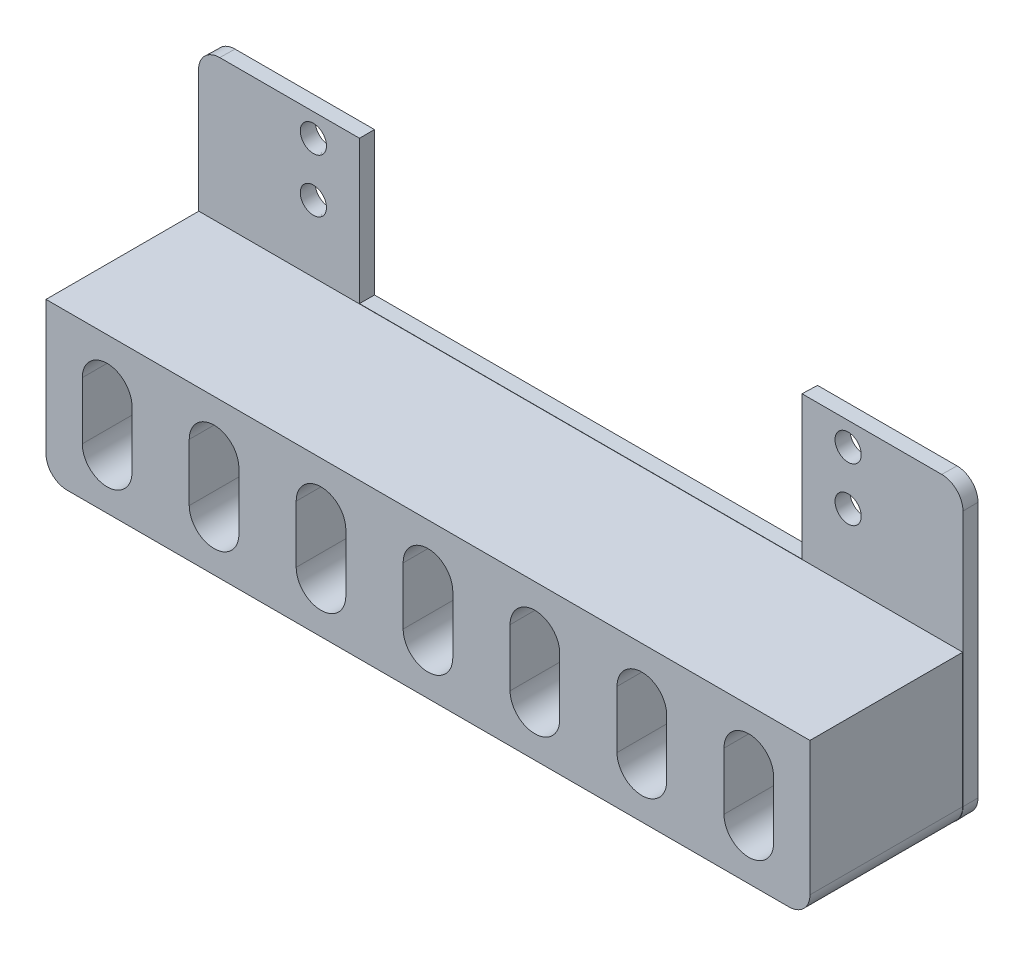
from build123d import *

# Parameters (mm, degrees)
SKETCH_1_R      = 1.75
EXTRUDE_3_DEPTH = 2
EXTRUDE_3_DRAFT = -1
EXTRUDE_4_DEPTH = 22


with BuildPart() as part:
    # 草图1 → 凸台-拉伸3 (with draft: the straight prism first)
    with BuildSketch(Plane.XY):
        with BuildLine():
            ThreePointArc((0, 2.744628665), (0.803883124, 0.803883124), (2.744628665, 0))
            Line((2.744628665, 0), (97.255371335, 0))
            ThreePointArc((97.255371335, 0), (99.196116876, 0.803883124), (100, 2.744628665))
            Line((100, 2.744628665), (100, 36.255371335))
            ThreePointArc((100, 36.255371335), (99.196116876, 38.196116876), (97.255371335, 39))
            Line((97.255371335, 39), (79, 39))
            Line((79, 39), (79, 20.25))
            Line((79, 20.25), (21, 20.25))
            Line((21, 20.25), (21, 39))
            Line((21, 39), (2.744628665, 39))
            ThreePointArc((2.744628665, 39), (0.803883124, 38.196116876), (0, 36.255371335))
            Line((0, 36.255371335), (0, 2.744628665))
        make_face()
        with BuildLine():
            ThreePointArc((11.25, 6.25), (8, 3), (4.75, 6.25))
            Line((4.75, 6.25), (4.75, 13.75))
            ThreePointArc((4.75, 13.75), (8, 17), (11.25, 13.75))
            Line((11.25, 13.75), (11.25, 6.25))
        make_face(mode=Mode.SUBTRACT)
        with BuildLine():
            ThreePointArc((25.25, 6.25), (22, 3), (18.75, 6.25))
            Line((18.75, 6.25), (18.75, 13.75))
            ThreePointArc((18.75, 13.75), (22, 17), (25.25, 13.75))
            Line((25.25, 13.75), (25.25, 6.25))
        make_face(mode=Mode.SUBTRACT)
        with BuildLine():
            ThreePointArc((39.25, 6.25), (36, 3), (32.75, 6.25))
            Line((32.75, 6.25), (32.75, 13.75))
            ThreePointArc((32.75, 13.75), (36, 17), (39.25, 13.75))
            Line((39.25, 13.75), (39.25, 6.25))
        make_face(mode=Mode.SUBTRACT)
        with BuildLine():
            ThreePointArc((53.25, 6.25), (50, 3), (46.75, 6.25))
            Line((46.75, 6.25), (46.75, 13.75))
            ThreePointArc((46.75, 13.75), (50, 17), (53.25, 13.75))
            Line((53.25, 13.75), (53.25, 6.25))
        make_face(mode=Mode.SUBTRACT)
        with BuildLine():
            ThreePointArc((67.25, 6.25), (64, 3), (60.75, 6.25))
            Line((60.75, 6.25), (60.75, 13.75))
            ThreePointArc((60.75, 13.75), (64, 17), (67.25, 13.75))
            Line((67.25, 13.75), (67.25, 6.25))
        make_face(mode=Mode.SUBTRACT)
        with BuildLine():
            ThreePointArc((81.25, 6.25), (78, 3), (74.75, 6.25))
            Line((74.75, 6.25), (74.75, 13.75))
            ThreePointArc((74.75, 13.75), (78, 17), (81.25, 13.75))
            Line((81.25, 13.75), (81.25, 6.25))
        make_face(mode=Mode.SUBTRACT)
        with BuildLine():
            ThreePointArc((95.25, 6.25), (92, 3), (88.75, 6.25))
            Line((88.75, 6.25), (88.75, 13.75))
            ThreePointArc((88.75, 13.75), (92, 17), (95.25, 13.75))
            Line((95.25, 13.75), (95.25, 6.25))
        make_face(mode=Mode.SUBTRACT)
        with Locations((15, 29)):
            Circle(SKETCH_1_R, mode=Mode.SUBTRACT)
        with Locations((85, 29)):
            Circle(SKETCH_1_R, mode=Mode.SUBTRACT)
        with Locations((15, 36)):
            Circle(SKETCH_1_R, mode=Mode.SUBTRACT)
        with Locations((85, 36)):
            Circle(SKETCH_1_R, mode=Mode.SUBTRACT)
    extrude(amount=EXTRUDE_3_DEPTH)
    # 凸台-拉伸3: the draft: its side faces are tilted about the plane it starts from
    extrude_3_sides = [part.faces().sort_by_distance(p)[0] for p in [
        (0, 19.5, 1),
        (0.803883124, 0.803883124, 1),
        (50, 0, 1),
        (99.196116876, 0.803883124, 1),
        (100, 19.5, 1),
        (99.196116876, 38.196116876, 1),
        (88.127685667, 39, 1),
        (79, 29.625, 1),
        (50, 20.25, 1),
        (21, 29.625, 1),
        (11.872314333, 39, 1),
        (0.803883124, 38.196116876, 1),
        (4.75, 10, 1),
        (8, 17, 1),
        (11.25, 10, 1),
        (8, 3, 1),
        (22, 17, 1),
        (25.25, 10, 1),
        (22, 3, 1),
        (18.75, 10, 1),
        (32.75, 10, 1),
        (36, 17, 1),
        (39.25, 10, 1),
        (36, 3, 1),
        (50, 3, 1),
        (46.75, 10, 1),
        (50, 17, 1),
        (53.25, 10, 1),
        (64, 17, 1),
        (67.25, 10, 1),
        (64, 3, 1),
        (60.75, 10, 1),
        (78, 17, 1),
        (81.25, 10, 1),
        (78, 3, 1),
        (74.75, 10, 1),
        (92, 17, 1),
        (95.25, 10, 1),
        (92, 3, 1),
        (88.75, 10, 1),
        (13.25, 29, 1),
        (83.25, 29, 1),
        (13.25, 36, 1),
        (83.25, 36, 1),
    ]]
    draft(extrude_3_sides, Plane.XY, EXTRUDE_3_DRAFT)

    # 草图1<8> → 凸台-拉伸4 (add)
    with BuildSketch(Plane.XY):
        with BuildLine():
            ThreePointArc((0, 2.744628665), (0.803883124, 0.803883124), (2.744628665, 0))
            Line((2.744628665, 0), (97.255371335, 0))
            ThreePointArc((97.255371335, 0), (99.196116876, 0.803883124), (100, 2.744628665))
            Line((100, 2.744628665), (100, 20.25))
            Line((100, 20.25), (79, 20.25))
            Line((79, 20.25), (21, 20.25))
            Line((21, 20.25), (0, 20.25))
            Line((0, 20.25), (0, 2.744628665))
        make_face()
        with BuildLine():
            ThreePointArc((11.25, 6.25), (8, 3), (4.75, 6.25))
            Line((4.75, 6.25), (4.75, 13.75))
            ThreePointArc((4.75, 13.75), (8, 17), (11.25, 13.75))
            Line((11.25, 13.75), (11.25, 6.25))
        make_face(mode=Mode.SUBTRACT)
        with BuildLine():
            ThreePointArc((25.25, 6.25), (22, 3), (18.75, 6.25))
            Line((18.75, 6.25), (18.75, 13.75))
            ThreePointArc((18.75, 13.75), (22, 17), (25.25, 13.75))
            Line((25.25, 13.75), (25.25, 6.25))
        make_face(mode=Mode.SUBTRACT)
        with BuildLine():
            ThreePointArc((39.25, 6.25), (36, 3), (32.75, 6.25))
            Line((32.75, 6.25), (32.75, 13.75))
            ThreePointArc((32.75, 13.75), (36, 17), (39.25, 13.75))
            Line((39.25, 13.75), (39.25, 6.25))
        make_face(mode=Mode.SUBTRACT)
        with BuildLine():
            ThreePointArc((53.25, 6.25), (50, 3), (46.75, 6.25))
            Line((46.75, 6.25), (46.75, 13.75))
            ThreePointArc((46.75, 13.75), (50, 17), (53.25, 13.75))
            Line((53.25, 13.75), (53.25, 6.25))
        make_face(mode=Mode.SUBTRACT)
        with BuildLine():
            ThreePointArc((67.25, 6.25), (64, 3), (60.75, 6.25))
            Line((60.75, 6.25), (60.75, 13.75))
            ThreePointArc((60.75, 13.75), (64, 17), (67.25, 13.75))
            Line((67.25, 13.75), (67.25, 6.25))
        make_face(mode=Mode.SUBTRACT)
        with BuildLine():
            ThreePointArc((81.25, 6.25), (78, 3), (74.75, 6.25))
            Line((74.75, 6.25), (74.75, 13.75))
            ThreePointArc((74.75, 13.75), (78, 17), (81.25, 13.75))
            Line((81.25, 13.75), (81.25, 6.25))
        make_face(mode=Mode.SUBTRACT)
        with BuildLine():
            ThreePointArc((95.25, 6.25), (92, 3), (88.75, 6.25))
            Line((88.75, 6.25), (88.75, 13.75))
            ThreePointArc((88.75, 13.75), (92, 17), (95.25, 13.75))
            Line((95.25, 13.75), (95.25, 6.25))
        make_face(mode=Mode.SUBTRACT)
    extrude(amount=EXTRUDE_4_DEPTH)


solid = part.part
